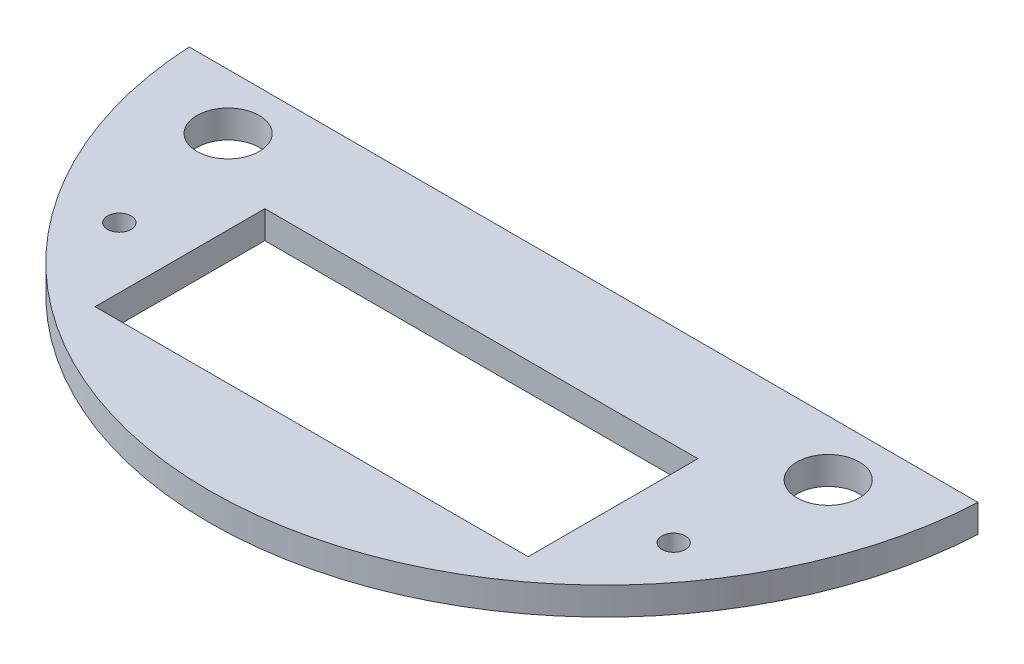
from build123d import *

# Parameters (mm, degrees)
ESQUISSE1_W             = 62.5
ESQUISSE1_H             = 24.5
BOSS_EXTRU_1_DEPTH      = 4
D_GAGEMENT_M81_D        = 9
ESQUISSE5_R             = 132
ESQUISSE5_R_2           = 57
ENL_V_MAT_EXTRU_1_DEPTH = 73.705605447
D_GAGEMENT_M31_D        = 3.4


with BuildPart() as part:
    # Esquisse1 → Boss.-Extru.1 (new body)
    with BuildSketch(Plane(origin=(0, 0, 0), x_dir=(1, 0, 0), z_dir=(0, 1, 0))):
        Polygon((-58.901607841, -13.53209338), (-58.901607841, 27), (59.427941441, 27), (59.427941441, -12.756380319), (59.427941441, -41.694422162), (-58.901607841, -41.694422162), align=None)
        Rectangle(ESQUISSE1_W, ESQUISSE1_H, mode=Mode.SUBTRACT)
    extrude(amount=BOSS_EXTRU_1_DEPTH)

    # Dégagement M81 (through all)
    with Locations(Plane(origin=(0, 4, 0), x_dir=(1, 0, 0), z_dir=(0, 1, 0))):
        with Locations((-43.3, 19), (43.3, 19)):
            Hole(D_GAGEMENT_M81_D / 2)

    # Esquisse5 → Enlèv. mat.-Extru.1 (cut, through all)
    with BuildSketch(Plane(origin=(0, 4, 0), x_dir=(1, 0, 0), z_dir=(0, 1, 0))):
        with Locations((0, 30)):
            Circle(ESQUISSE5_R)
        with Locations((0, 30)):
            Circle(ESQUISSE5_R_2, mode=Mode.SUBTRACT)
    extrude(amount=-ENL_V_MAT_EXTRU_1_DEPTH, mode=Mode.SUBTRACT)

    # Dégagement M31 (through all)
    with Locations(Plane(origin=(0, 0, 0), x_dir=(-1, 0, 0), z_dir=(0, -1, 0))):
        with Locations((-40, 0), (40, 0)):
            Hole(D_GAGEMENT_M31_D / 2)


solid = part.part
